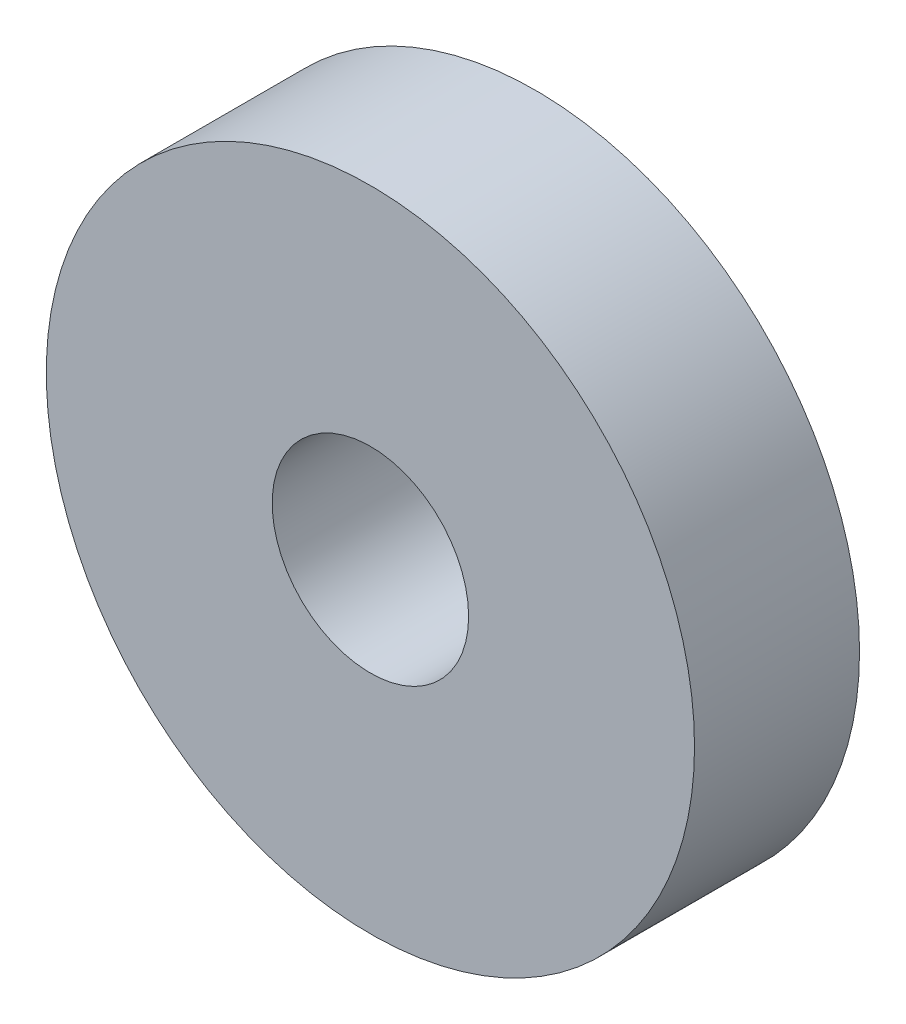
from build123d import *

# Parameters (mm, degrees)
SKETCH2_R           = 7.857797854
SKETCH2_R_2         = 2.38125
BOSS_EXTRUDE1_DEPTH = 2


with BuildPart() as part:
    # Sketch2 → Boss-Extrude1 (new, symmetric)
    with BuildSketch(Plane.XY):
        Circle(SKETCH2_R)
        Circle(SKETCH2_R_2, mode=Mode.SUBTRACT)
    extrude(amount=BOSS_EXTRUDE1_DEPTH, both=True)


solid = part.part
